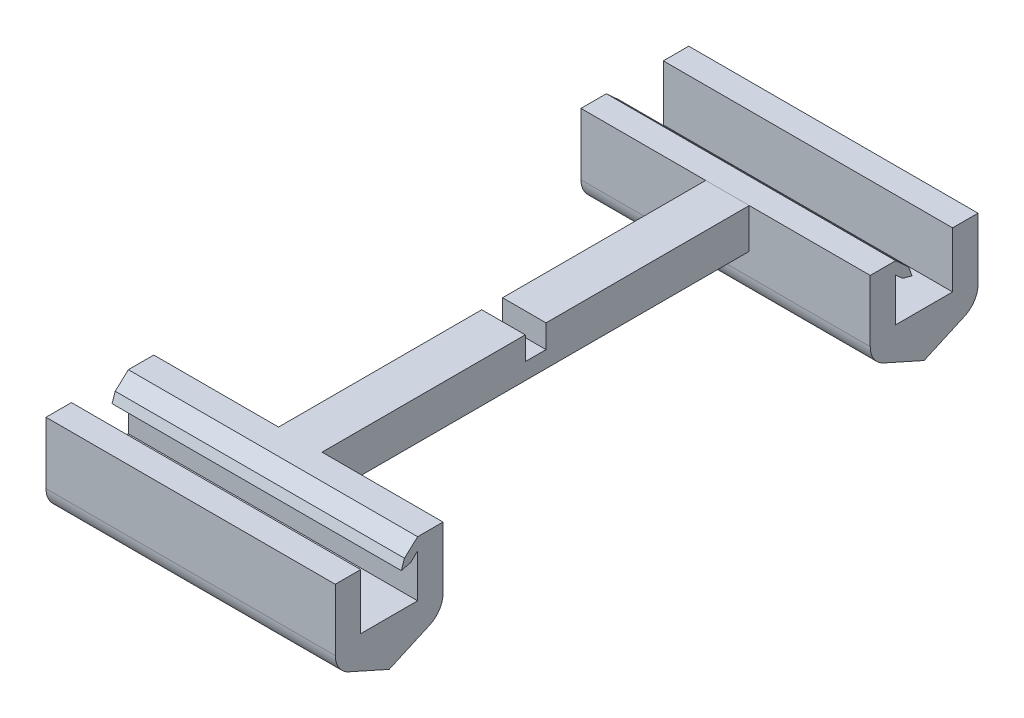
from build123d import *

# Parameters (mm, degrees)
BOSS_EXTRUDE1_DEPTH   = 12.7
BOSS_EXTRUDE1_2_DEPTH = 12.7
BOSS_EXTRUDE2_REACH   = 29.048
SKETCH3_W             = 0.912
SKETCH3_H             = 1.017292505
CUT_EXTRUDE1_DEPTH    = 1.90971


with BuildPart() as part:
    # Sketch1 → Boss-Extrude1 (new body)
    with BuildSketch(Plane(origin=(0, 0, 0), x_dir=(0, 0, -1), z_dir=(1, 0, 0))):
        with BuildLine():
            Line((10.799625276, -0.72499139), (10.493513826, -0.443398668))
            Line((10.493513826, -0.443398668), (10.493513826, -2.337314401))
            Line((10.493513826, -2.337314401), (12.993513826, -2.337314401))
            Line((12.993513826, -2.337314401), (12.993513826, 0.100104166))
            Line((12.993513826, 0.100104166), (14.109368157, 0.100104166))
            Line((14.109368157, 0.100104166), (14.109368157, -2.61336902))
            ThreePointArc((14.109368157, -2.61336902), (13.948601253, -3.157140857), (13.517992535, -3.526071664))
            Line((13.517992535, -3.526071664), (11.743513826, -4.320520177))
            Line((11.743513826, -4.320520177), (9.969035116, -3.526071664))
            ThreePointArc((9.969035116, -3.526071664), (9.538426398, -3.157140857), (9.377659494, -2.61336902))
            Line((9.377659494, -2.61336902), (9.377659494, 0.100104166))
            Line((9.377659494, 0.100104166), (10.493513826, 0.100104166))
            Line((10.493513826, 0.100104166), (11.070432361, -0.430604701))
            Line((11.070432361, -0.430604701), (11.210561844, -0.831261596))
            Line((11.210561844, -0.831261596), (10.799625276, -0.72499139))
        make_face()
    extrude(amount=BOSS_EXTRUDE1_DEPTH)


with BuildPart() as body_2:
    # Sketch1 → Boss-Extrude1 2 (new body)
    with BuildSketch(Plane(origin=(0, 0, 0), x_dir=(0, 0, -1), z_dir=(1, 0, 0))):
        with BuildLine():
            Line((-10.493513826, 0.100104166), (-9.377659494, 0.100104166))
            Line((-9.377659494, 0.100104166), (-9.377659494, -2.61336902))
            ThreePointArc((-9.377659494, -2.61336902), (-9.538426398, -3.157140857), (-9.969035116, -3.526071664))
            Line((-9.969035116, -3.526071664), (-11.743513826, -4.320520177))
            Line((-11.743513826, -4.320520177), (-13.517992535, -3.526071664))
            ThreePointArc((-13.517992535, -3.526071664), (-13.948601253, -3.157140857), (-14.109368157, -2.61336902))
            Line((-14.109368157, -2.61336902), (-14.109368157, 0.100104166))
            Line((-14.109368157, 0.100104166), (-12.993513826, 0.100104166))
            Line((-12.993513826, 0.100104166), (-12.993513826, -2.337314401))
            Line((-12.993513826, -2.337314401), (-10.493513826, -2.337314401))
            Line((-10.493513826, -2.337314401), (-10.493513826, -0.443398668))
            Line((-10.493513826, -0.443398668), (-10.799625276, -0.72499139))
            Line((-10.799625276, -0.72499139), (-11.210561844, -0.831261596))
            Line((-11.210561844, -0.831261596), (-11.070432361, -0.430604701))
            Line((-11.070432361, -0.430604701), (-10.493513826, 0.100104166))
        make_face()
    extrude(amount=BOSS_EXTRUDE1_2_DEPTH)

    # Sketch2 → Boss-Extrude2 (add, up to next)
    with BuildSketch(Plane.XY.offset(-9.377659494), mode=Mode.PRIVATE) as boss_extrude2_sk1:
        Polygon((5.47811731, 0.100104166), (7.387826905, 0.100104166), (7.387826905, -1.641579788), (6.432972108, -2.596434586), (5.47811731, -1.641579788), align=None)
    boss_extrude2_tool1 = extrude(boss_extrude2_sk1.sketch, amount=BOSS_EXTRUDE2_REACH, mode=Mode.PRIVATE) - body_2.part
    add(boss_extrude2_tool1.solids().sort_by_distance((6.432972, -1.026571, -9.377659))[0])

    # Sketch3 → Cut-Extrude1 (cut)
    with BuildSketch(Plane.ZY.offset(-5.47811731)):
        with Locations((0, -0.408542087)):
            Rectangle(SKETCH3_W, SKETCH3_H)
    extrude(amount=-CUT_EXTRUDE1_DEPTH, mode=Mode.SUBTRACT)


solid = Compound([part.part, body_2.part])
